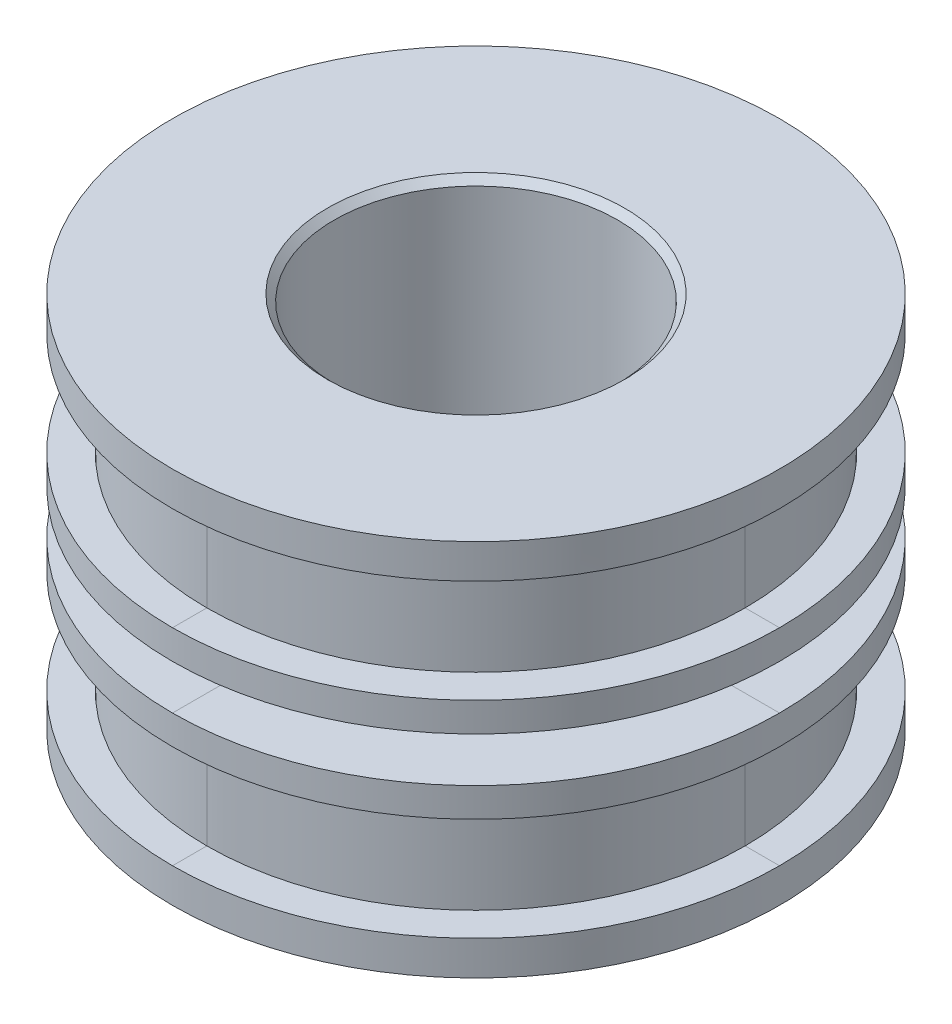
from build123d import *

# Parameters (mm, degrees)
SKETCH1_R           = 44.175
BOSS_EXTRUDE1_DEPTH = 27.5
SKETCH3_W           = 11
SKETCH3_H           = 6.5
SKETCH4_W           = 5
SKETCH4_H           = 15
SKETCH9_R           = 20.625
CUT_EXTRUDE2_DEPTH  = 84.233774695
CHAMFER1_SIZE       = 1
SKETCH10_R          = 24.5
CUT_EXTRUDE3_DEPTH  = 15
CHAMFER2_SIZE       = 1


with BuildPart() as part:
    # Sketch1 → Boss-Extrude1 (new, symmetric)
    with BuildSketch(Plane(origin=(0, 0, 0), x_dir=(1, 0, 0), z_dir=(0, 1, 0))):
        with Locations(Location((0, 0, 0), (0, 0, 270))):
            Circle(SKETCH1_R)
    extrude(amount=BOSS_EXTRUDE1_DEPTH, both=True)

    # Cut-Sweep1: sweep along a curve in space
    with BuildLine() as cut_sweep1_path:
        ThreePointArc((0, 27.5, 44.175), (31.236442059, 27.5, 31.236442059), (44.175, 27.5, 0))
        ThreePointArc((44.175, 27.5, 0), (31.236442059, 27.5, -31.236442059), (0, 27.5, -44.175))
        ThreePointArc((0, 27.5, -44.175), (-31.236442059, 27.5, -31.236442059), (-44.175, 27.5, 0))
        ThreePointArc((-44.175, 27.5, 0), (-31.236442059, 27.5, 31.236442059), (0, 27.5, 44.175))
    # Sketch3 → Cut-Sweep1 (sweep, cut)
    with BuildSketch(Plane.XY):
        with Locations((38.675, 0)):
            Rectangle(SKETCH3_W, SKETCH3_H)
    sweep(path=cut_sweep1_path.line, mode=Mode.SUBTRACT)

    # Cut-Sweep2: sweep along a curve in space
    with BuildLine() as cut_sweep2_path:
        ThreePointArc((0, 27.5, 44.175), (31.236442059, 27.5, 31.236442059), (44.175, 27.5, 0))
        ThreePointArc((44.175, 27.5, 0), (31.236442059, 27.5, -31.236442059), (0, 27.5, -44.175))
        ThreePointArc((0, 27.5, -44.175), (-31.236442059, 27.5, -31.236442059), (-44.175, 27.5, 0))
        ThreePointArc((-44.175, 27.5, 0), (-31.236442059, 27.5, 31.236442059), (0, 27.5, 44.175))
    # Sketch4 → Cut-Sweep2 (sweep, cut)
    with BuildSketch(Plane.XY):
        with Locations((41.675, 15)):
            Rectangle(SKETCH4_W, SKETCH4_H)
    cut_sweep2 = sweep(path=cut_sweep2_path.line, mode=Mode.SUBTRACT)

    # Mirror1: Cut-Sweep2 across plane
    add(cut_sweep2.mirror(Plane.ZX), mode=Mode.SUBTRACT)

    # Sketch9 → Cut-Extrude2 (cut, through all)
    with BuildSketch(Plane(origin=(0, 27.5, 0), x_dir=(1, 0, 0), z_dir=(0, 1, 0))):
        with Locations(Location((0, 0, 0), (0, 0, 270))):
            Circle(SKETCH9_R)
    extrude(amount=-CUT_EXTRUDE2_DEPTH, mode=Mode.SUBTRACT)

    # Chamfer1
    chamfer1_edges = [part.edges().sort_by_distance(p)[0] for p in [
        (0, 27.5, -20.625),
    ]]
    chamfer(chamfer1_edges, length=CHAMFER1_SIZE)

    # Sketch10 → Cut-Extrude3 (cut)
    with BuildSketch(Plane.XZ.offset(27.5)):
        with Locations(Location((0, 0, 0), (0, 0, 270))):
            Circle(SKETCH10_R)
    extrude(amount=-CUT_EXTRUDE3_DEPTH, mode=Mode.SUBTRACT)

    # Chamfer2
    chamfer2_edges = [part.edges().sort_by_distance(p)[0] for p in [
        (0, -27.5, 24.5),
    ]]
    chamfer(chamfer2_edges, length=CHAMFER2_SIZE)


solid = part.part
